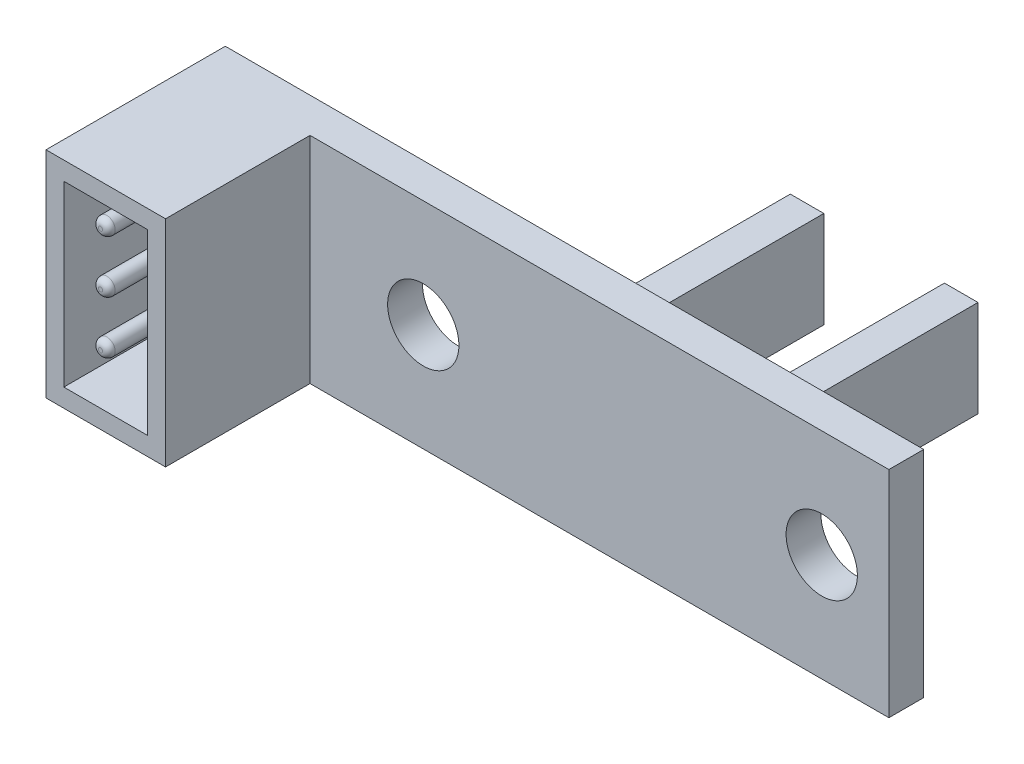
from build123d import *

# Parameters (mm, degrees)
SKETCH_1_W          = 33.3
SKETCH_1_H          = 10.25
EXTRUDE_1_DEPTH     = 1.66
SKETCH_2_W          = 5.7
SKETCH_2_H          = 10.25
EXTRUDE_3_DEPTH     = 6.89
SKETCH_3_W          = 4
SKETCH_3_H          = 8.5
CUT_EXTRUDE_1_DEPTH = 6.05
SKETCH_4_R          = 0.4
EXTRUDE_4_DEPTH     = 5.5
FILLET_1_R          = 0.3
SKETCH_5_R          = 1.7
CUT_EXTRUDE_2_DEPTH = 36.516539809
SKETCH_6_W          = 1.6
SKETCH_6_H          = 4.6
EXTRUDE_5_DEPTH     = 10.19


with BuildPart() as part:
    # Эскиз1 → Бобышка-Вытянуть1 (new body)
    with BuildSketch(Plane.XY):
        with Locations((16.65, 5.125)):
            Rectangle(SKETCH_1_W, SKETCH_1_H)
    extrude(amount=EXTRUDE_1_DEPTH)

    # Эскиз2 → Бобышка-Вытянуть3 (add)
    with BuildSketch(Plane.XY.offset(1.66)):
        with Locations((2.85, 5.125)):
            Rectangle(SKETCH_2_W, SKETCH_2_H)
    extrude(amount=EXTRUDE_3_DEPTH)

    # Эскиз3 → Вырез-Вытянуть1 (cut)
    with BuildSketch(Plane.XY.offset(8.55)):
        with Locations((2.85, 5.125)):
            Rectangle(SKETCH_3_W, SKETCH_3_H)
    extrude(amount=-CUT_EXTRUDE_1_DEPTH, mode=Mode.SUBTRACT)

    # Эскиз4 → Бобышка-Вытянуть4 (add)
    with BuildSketch(Plane.XY.offset(2.5)):
        with Locations((2.050760191, 5.231038637)):
            Circle(SKETCH_4_R)
        with Locations((2.050760191, 7.741038637)):
            Circle(SKETCH_4_R)
        with Locations((2.050760191, 2.721038637)):
            Circle(SKETCH_4_R)
    extrude(amount=EXTRUDE_4_DEPTH)

    # Скругление1
    fillet_1_edges = [part.edges().sort_by_distance(p)[0] for p in [
        (1.650760191, 5.231038637, 8),
        (1.650760191, 7.741038637, 8),
        (1.650760191, 2.721038637, 8),
    ]]
    fillet(fillet_1_edges, radius=FILLET_1_R)

    # Эскиз5 → Вырез-Вытянуть2 (cut, through all)
    with BuildSketch(Plane.XY.offset(1.66)):
        with Locations((11.1, 5.125)):
            Circle(SKETCH_5_R)
        with Locations((30.1, 5.125)):
            Circle(SKETCH_5_R)
    extrude(amount=-CUT_EXTRUDE_2_DEPTH, mode=Mode.SUBTRACT)

    # Эскиз6 → Бобышка-Вытянуть5 (add)
    with BuildSketch(Plane(origin=(0, 0, 0), x_dir=(-1, 0, 0), z_dir=(0, 0, -1))):
        with Locations((-24.9, 5.125)):
            Rectangle(SKETCH_6_W, SKETCH_6_H)
        with Locations((-17.55, 5.125)):
            Rectangle(SKETCH_6_W, SKETCH_6_H)
    extrude(amount=EXTRUDE_5_DEPTH)


solid = part.part
